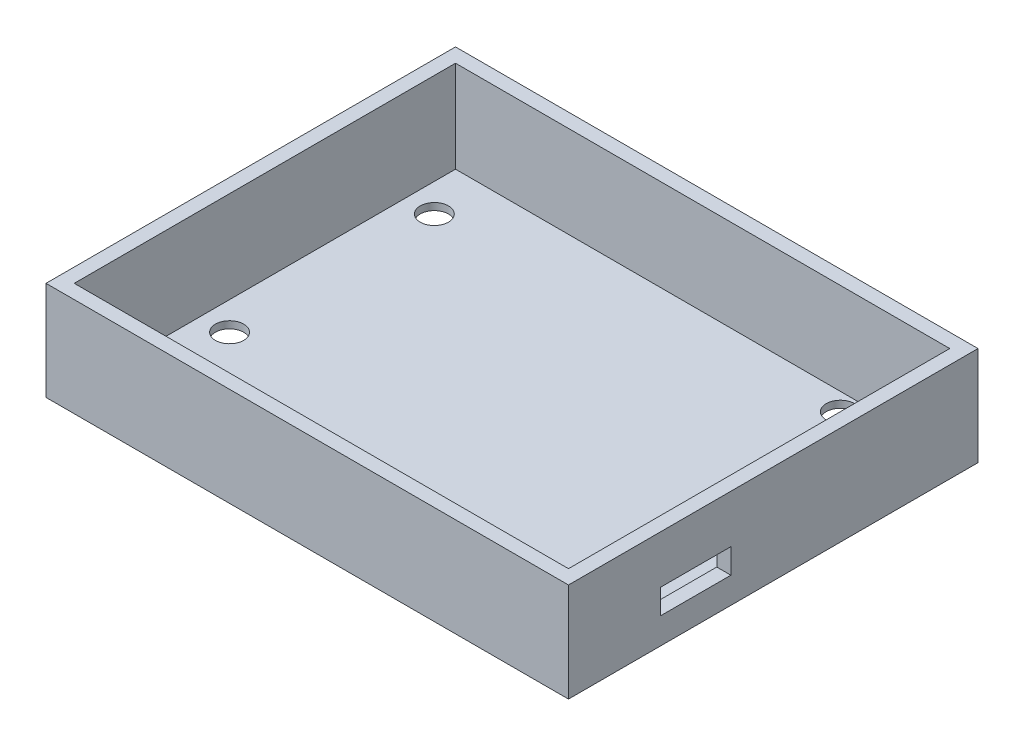
from build123d import *

# Parameters (mm, degrees)
IZIM1_W                     = 72
IZIM1_H                     = 56
Y_KSEKLIK_EKSTR_ZYON2_DEPTH = 1
IZIM3_W                     = 72
IZIM3_H                     = 56
IZIM3_W_2                   = 70
IZIM3_H_2                   = 54
EKSTR_ZYON_NCE2_DEPTH       = 13
IZIM4_W                     = 10
IZIM4_H                     = 4
KES_EKSTR_ZYON1_DEPTH       = 1
IZIM5_R                     = 2
KES_EKSTR_ZYON2_DEPTH       = 1
IZIM6_W                     = 1
IZIM6_H                     = 14
Y_KSEKLIK_EKSTR_ZYON3_DEPTH = 56
IZIM7_W                     = 10
IZIM7_H                     = 3
KES_EKSTR_ZYON3_DEPTH       = 1
IZIM8_W                     = 74
IZIM8_H                     = 58
IZIM8_W_2                   = 72
IZIM8_H_2                   = 56
EKSTR_ZYON_NCE4_DEPTH       = 13
IZIM9_W                     = 10
IZIM9_H                     = 5
KES_EKSTR_ZYON4_DEPTH       = 1
IZIM10_W                    = 10
IZIM10_H                    = 1.5
Y_KSEKLIK_EKSTR_ZYON4_DEPTH = 2
IZIM11_W                    = 10
IZIM11_H                    = 3.5
KES_EKSTR_ZYON5_DEPTH       = 2
IZIM12_W                    = 74
IZIM12_H                    = 58
IZIM12_W_2                  = 72
IZIM12_H_2                  = 56
EKSTR_ZYON_NCE5_DEPTH       = 1


with BuildPart() as part:
    # Çizim1 → Yükseklik-Ekstrüzyon2 (new body)
    with BuildSketch(Plane(origin=(0, 0, 0), x_dir=(1, 0, 0), z_dir=(0, 1, 0))):
        Rectangle(IZIM1_W, IZIM1_H)
    extrude(amount=Y_KSEKLIK_EKSTR_ZYON2_DEPTH)

    # Çizim3 → Ekstrüzyon-İnce2 (add)
    with BuildSketch(Plane(origin=(0, 1, 0), x_dir=(1, 0, 0), z_dir=(0, 1, 0))):
        Rectangle(IZIM3_W, IZIM3_H)
        Rectangle(IZIM3_W_2, IZIM3_H_2, mode=Mode.SUBTRACT)
    extrude(amount=EKSTR_ZYON_NCE2_DEPTH)

    # Çizim4 → Kes-Ekstrüzyon1 (cut)
    with BuildSketch(Plane.ZY.offset(-35)):
        with Locations((20.9, 4)):
            Rectangle(IZIM4_W, IZIM4_H)
    extrude(amount=-KES_EKSTR_ZYON1_DEPTH, mode=Mode.SUBTRACT)

    # Çizim5 → Kes-Ekstrüzyon2 (cut)
    with BuildSketch(Plane(origin=(0, 1, 0), x_dir=(1, 0, 0), z_dir=(0, 1, 0))):
        with Locations(Location((19.5, -24, 0), (0, 0, 270))):
            Circle(IZIM5_R)
        with Locations(Location((22, 24.5, 0), (0, 0, 270))):
            Circle(IZIM5_R)
        with Locations(Location((-31, -9, 0), (0, 0, 270))):
            Circle(IZIM5_R)
        with Locations(Location((-31, 20, 0), (0, 0, 270))):
            Circle(IZIM5_R)
    extrude(amount=-KES_EKSTR_ZYON2_DEPTH, mode=Mode.SUBTRACT)

    # Çizim6 → Yükseklik-Ekstrüzyon3 (add)
    with BuildSketch(Plane.XY.offset(28)):
        with Locations((35.5, 7)):
            Rectangle(IZIM6_W, IZIM6_H)
    extrude(amount=-Y_KSEKLIK_EKSTR_ZYON3_DEPTH)

    # Çizim7 → Kes-Ekstrüzyon3 (cut)
    with BuildSketch(Plane.ZY.offset(-35)):
        with Locations((11, 3.7)):
            Rectangle(IZIM7_W, IZIM7_H)
    extrude(amount=-KES_EKSTR_ZYON3_DEPTH, mode=Mode.SUBTRACT)

    # Çizim8 → Ekstrüzyon-İnce4 (add)
    with BuildSketch(Plane(origin=(0, 1, 0), x_dir=(1, 0, 0), z_dir=(0, 1, 0))):
        Rectangle(IZIM8_W, IZIM8_H)
        Rectangle(IZIM8_W_2, IZIM8_H_2, mode=Mode.SUBTRACT)
    extrude(amount=EKSTR_ZYON_NCE4_DEPTH)

    # Çizim9 → Kes-Ekstrüzyon4 (cut)
    with BuildSketch(Plane.ZY.offset(-35)):
        with Locations((11, 4.7)):
            Rectangle(IZIM9_W, IZIM9_H)
    extrude(amount=-KES_EKSTR_ZYON4_DEPTH, mode=Mode.SUBTRACT)

    # Çizim10 → Yükseklik-Ekstrüzyon4 (add)
    with BuildSketch(Plane.ZY.offset(-35)):
        with Locations((11, 2.95)):
            Rectangle(IZIM10_W, IZIM10_H)
    extrude(amount=-Y_KSEKLIK_EKSTR_ZYON4_DEPTH)

    # Çizim11 → Kes-Ekstrüzyon5 (cut)
    with BuildSketch(Plane.ZY.offset(-35)):
        with Locations((11, 5.45)):
            Rectangle(IZIM11_W, IZIM11_H)
    extrude(amount=-KES_EKSTR_ZYON5_DEPTH, mode=Mode.SUBTRACT)

    # Çizim12 → Ekstrüzyon-İnce5 (add)
    with BuildSketch(Plane.XZ.offset(-1)):
        Rectangle(IZIM12_W, IZIM12_H)
        Rectangle(IZIM12_W_2, IZIM12_H_2, mode=Mode.SUBTRACT)
    extrude(amount=EKSTR_ZYON_NCE5_DEPTH)


solid = part.part
